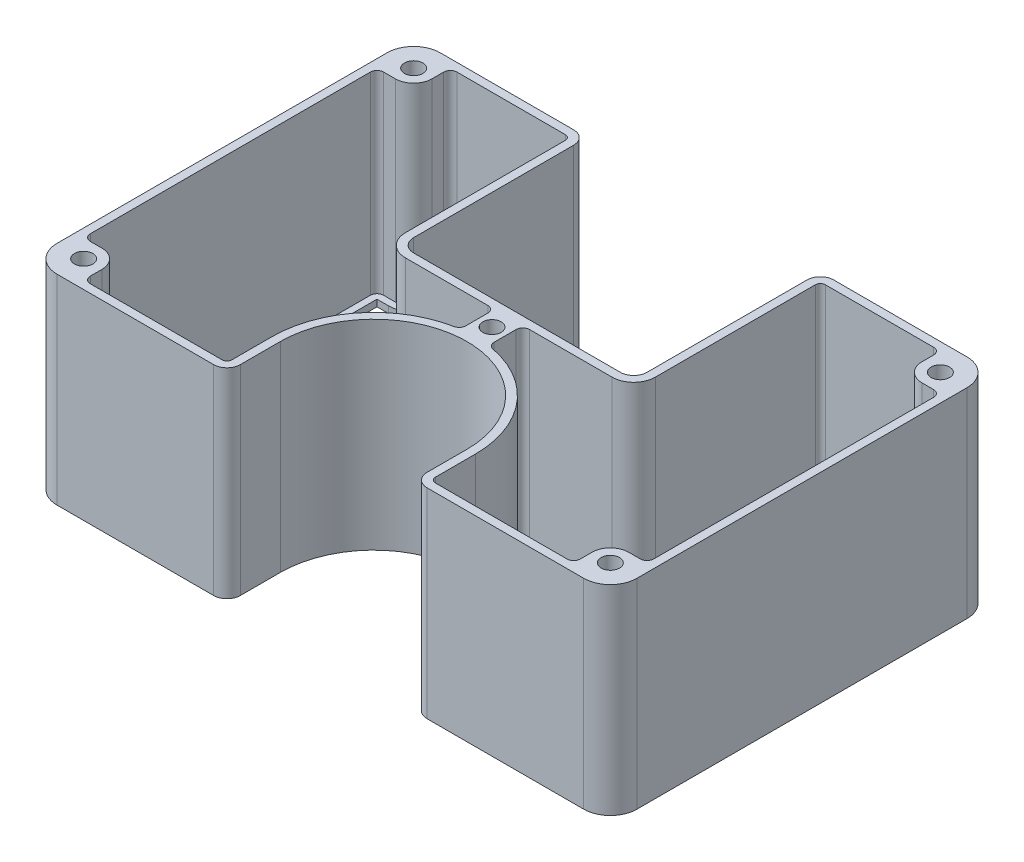
from build123d import *

# Parameters (mm, degrees)
SKETCH2_R           = 2.75
BOSS_EXTRUDE1_DEPTH = 60
BOSS_EXTRUDE2_DEPTH = 2


with BuildPart() as part:
    # Sketch2 → Boss-Extrude1 (new body)
    with BuildSketch(Plane(origin=(0, 0, 0), x_dir=(1, 0, 0), z_dir=(0, 1, 0))):
        with BuildLine():
            Line((87, -11), (87, 88))
            ThreePointArc((87, 88), (84.656854249, 93.656854249), (79, 96))
            Line((79, 96), (39, 96))
            ThreePointArc((39, 96), (36.171572875, 94.828427125), (35, 92))
            Line((35, 92), (35, 44))
            ThreePointArc((35, 44), (33.828427125, 41.171572875), (31, 40))
            Line((31, 40), (-31, 40))
            ThreePointArc((-31, 40), (-33.828427125, 41.171572875), (-35, 44))
            Line((-35, 44), (-35, 92))
            ThreePointArc((-35, 92), (-36.171572875, 94.828427125), (-39, 96))
            Line((-39, 96), (-79, 96))
            ThreePointArc((-79, 96), (-84.656854249, 93.656854249), (-87, 88))
            Line((-87, 88), (-87, -11))
            ThreePointArc((-87, -11), (-84.656854249, -16.656854249), (-79, -19))
            Line((-79, -19), (-32, -19))
            ThreePointArc((-32, -19), (-29.171572875, -17.828427125), (-28, -15))
            Line((-28, -15), (-28, -3))
            ThreePointArc((-28, -3), (0, 25), (28, -3))
            Line((28, -3), (28, -15))
            ThreePointArc((28, -15), (29.171572875, -17.828427125), (32, -19))
            Line((32, -19), (79, -19))
            ThreePointArc((79, -19), (84.656854249, -16.656854249), (87, -11))
        make_face()
        with Locations(Location((-79, 88, 0), (0, 0, 270))):
            Circle(SKETCH2_R, mode=Mode.SUBTRACT)
        with Locations(Location((79, 88, 0), (0, 0, 270))):
            Circle(SKETCH2_R, mode=Mode.SUBTRACT)
        with Locations(Location((79, -11, 0), (0, 0, 270))):
            Circle(SKETCH2_R, mode=Mode.SUBTRACT)
        with Locations(Location((-79, -11, 0), (0, 0, 270))):
            Circle(SKETCH2_R, mode=Mode.SUBTRACT)
        with Locations(Location((0, 32.5, 0), (0, 0, 270))):
            Circle(SKETCH2_R, mode=Mode.SUBTRACT)
        with BuildLine():
            Line((-39, 93.5), (-71.5, 93.5))
            ThreePointArc((-71.5, 93.5), (-72.914213562, 92.914213562), (-73.5, 91.5))
            Line((-73.5, 91.5), (-73.5, 88))
            ThreePointArc((-73.5, 88), (-75.110912703, 84.110912703), (-79, 82.5))
            Line((-79, 82.5), (-82.5, 82.5))
            ThreePointArc((-82.5, 82.5), (-83.914213562, 81.914213562), (-84.5, 80.5))
            Line((-84.5, 80.5), (-84.5, -3.5))
            ThreePointArc((-84.5, -3.5), (-83.914213562, -4.914213562), (-82.5, -5.5))
            Line((-82.5, -5.5), (-79, -5.5))
            ThreePointArc((-79, -5.5), (-75.110912703, -7.110912703), (-73.5, -11))
            Line((-73.5, -11), (-73.5, -14.5))
            ThreePointArc((-73.5, -14.5), (-72.914213562, -15.914213562), (-71.5, -16.5))
            Line((-71.5, -16.5), (-32, -16.5))
            ThreePointArc((-32, -16.5), (-30.939339828, -16.060660172), (-30.5, -15))
            Line((-30.5, -15), (-30.5, -3))
            ThreePointArc((-30.5, -3), (-23.549354883, 16.382411734), (-5.865384615, 26.930707698))
            ThreePointArc((-5.865384615, 26.930707698), (-4.705780008, 27.622399237), (-4.25, 28.893377055))
            Line((-4.25, 28.893377055), (-4.25, 35.5))
            ThreePointArc((-4.25, 35.5), (-4.835786438, 36.914213562), (-6.25, 37.5))
            Line((-6.25, 37.5), (-31, 37.5))
            ThreePointArc((-31, 37.5), (-35.596194078, 39.403805922), (-37.5, 44))
            Line((-37.5, 44), (-37.5, 92))
            ThreePointArc((-37.5, 92), (-37.939339828, 93.060660172), (-39, 93.5))
        make_face(mode=Mode.SUBTRACT)
        with BuildLine():
            Line((30.5, -15), (30.5, -3))
            ThreePointArc((30.5, -3), (23.549354883, 16.382411734), (5.865384615, 26.930707698))
            ThreePointArc((5.865384615, 26.930707698), (4.705780008, 27.622399237), (4.25, 28.893377055))
            Line((4.25, 28.893377055), (4.25, 35.5))
            ThreePointArc((4.25, 35.5), (4.835786438, 36.914213562), (6.25, 37.5))
            Line((6.25, 37.5), (31, 37.5))
            ThreePointArc((31, 37.5), (35.596194078, 39.403805922), (37.5, 44))
            Line((37.5, 44), (37.5, 92))
            ThreePointArc((37.5, 92), (37.939339828, 93.060660172), (39, 93.5))
            Line((39, 93.5), (71.5, 93.5))
            ThreePointArc((71.5, 93.5), (72.914213562, 92.914213562), (73.5, 91.5))
            Line((73.5, 91.5), (73.5, 88))
            ThreePointArc((73.5, 88), (75.110912703, 84.110912703), (79, 82.5))
            Line((79, 82.5), (82.5, 82.5))
            ThreePointArc((82.5, 82.5), (83.914213562, 81.914213562), (84.5, 80.5))
            Line((84.5, 80.5), (84.5, -3.5))
            ThreePointArc((84.5, -3.5), (83.914213562, -4.914213562), (82.5, -5.5))
            Line((82.5, -5.5), (79, -5.5))
            ThreePointArc((79, -5.5), (75.110912703, -7.110912703), (73.5, -11))
            Line((73.5, -11), (73.5, -14.5))
            ThreePointArc((73.5, -14.5), (72.914213562, -15.914213562), (71.5, -16.5))
            Line((71.5, -16.5), (32, -16.5))
            ThreePointArc((32, -16.5), (30.939339828, -16.060660172), (30.5, -15))
        make_face(mode=Mode.SUBTRACT)
    extrude(amount=BOSS_EXTRUDE1_DEPTH)

    # Sketch3 → Boss-Extrude2 (add)
    # profile 1 of 2: a face of its own
    with BuildSketch(Plane.XZ):
        with BuildLine():
            Line((-37.5, -92), (-37.5, -44))
            ThreePointArc((-37.5, -44), (-35.596194078, -39.403805922), (-31, -37.5))
            Line((-31, -37.5), (-6.25, -37.5))
            ThreePointArc((-6.25, -37.5), (-4.835786438, -36.914213562), (-4.25, -35.5))
            Line((-4.25, -35.5), (-4.25, -28.893377055))
            ThreePointArc((-4.25, -28.893377055), (-4.705780008, -27.622399237), (-5.865384615, -26.930707698))
            ThreePointArc((-5.865384615, -26.930707698), (-23.549354883, -16.382411734), (-30.5, 3))
            Line((-30.5, 3), (-30.5, 15))
            ThreePointArc((-30.5, 15), (-30.939339828, 16.060660172), (-32, 16.5))
            Line((-32, 16.5), (-71.5, 16.5))
            ThreePointArc((-71.5, 16.5), (-72.914213562, 15.914213562), (-73.5, 14.5))
            Line((-73.5, 14.5), (-73.5, 11))
            ThreePointArc((-73.5, 11), (-75.110912703, 7.110912703), (-79, 5.5))
            Line((-79, 5.5), (-82.5, 5.5))
            ThreePointArc((-82.5, 5.5), (-83.914213562, 4.914213562), (-84.5, 3.5))
            Line((-84.5, 3.5), (-84.5, -80.5))
            ThreePointArc((-84.5, -80.5), (-83.914213562, -81.914213562), (-82.5, -82.5))
            Line((-82.5, -82.5), (-79, -82.5))
            ThreePointArc((-79, -82.5), (-75.110912703, -84.110912703), (-73.5, -88))
            Line((-73.5, -88), (-73.5, -91.5))
            ThreePointArc((-73.5, -91.5), (-72.914213562, -92.914213562), (-71.5, -93.5))
            Line((-71.5, -93.5), (-39, -93.5))
            ThreePointArc((-39, -93.5), (-37.939339828, -93.060660172), (-37.5, -92))
        make_face()
        with BuildLine():
            Line((-39.5, -91.5), (-39.5, -44))
            ThreePointArc((-39.5, -44), (-37.01040764, -37.98959236), (-31, -35.5))
            Line((-31, -35.5), (-6.25, -35.5))
            Line((-6.25, -35.5), (-6.25, -28.893377055))
            ThreePointArc((-6.25, -28.893377055), (-25.093574875, -17.653389552), (-32.5, 3))
            Line((-32.5, 3), (-32.5, 14.5))
            Line((-32.5, 14.5), (-71.5, 14.5))
            Line((-71.5, 14.5), (-71.5, 11))
            ThreePointArc((-71.5, 11), (-73.696699141, 5.696699141), (-79, 3.5))
            Line((-79, 3.5), (-82.5, 3.5))
            Line((-82.5, 3.5), (-82.5, -80.5))
            Line((-82.5, -80.5), (-79, -80.5))
            ThreePointArc((-79, -80.5), (-73.696699141, -82.696699141), (-71.5, -88))
            Line((-71.5, -88), (-71.5, -91.5))
            Line((-71.5, -91.5), (-39.5, -91.5))
        make_face(mode=Mode.SUBTRACT)
    # profile 2 of 2: a face of its own
    with BuildSketch(Plane.XZ):
        with BuildLine():
            Line((30.5, 15), (30.5, 3))
            ThreePointArc((30.5, 3), (23.549354883, -16.382411734), (5.865384615, -26.930707698))
            ThreePointArc((5.865384615, -26.930707698), (4.705780008, -27.622399237), (4.25, -28.893377055))
            Line((4.25, -28.893377055), (4.25, -35.5))
            ThreePointArc((4.25, -35.5), (4.835786438, -36.914213562), (6.25, -37.5))
            Line((6.25, -37.5), (31, -37.5))
            ThreePointArc((31, -37.5), (35.596194078, -39.403805922), (37.5, -44))
            Line((37.5, -44), (37.5, -92))
            ThreePointArc((37.5, -92), (37.939339828, -93.060660172), (39, -93.5))
            Line((39, -93.5), (71.5, -93.5))
            ThreePointArc((71.5, -93.5), (72.914213562, -92.914213562), (73.5, -91.5))
            Line((73.5, -91.5), (73.5, -88))
            ThreePointArc((73.5, -88), (75.110912703, -84.110912703), (79, -82.5))
            Line((79, -82.5), (82.5, -82.5))
            ThreePointArc((82.5, -82.5), (83.914213562, -81.914213562), (84.5, -80.5))
            Line((84.5, -80.5), (84.5, 3.5))
            ThreePointArc((84.5, 3.5), (83.914213562, 4.914213562), (82.5, 5.5))
            Line((82.5, 5.5), (79, 5.5))
            ThreePointArc((79, 5.5), (75.110912703, 7.110912703), (73.5, 11))
            Line((73.5, 11), (73.5, 14.5))
            ThreePointArc((73.5, 14.5), (72.914213562, 15.914213562), (71.5, 16.5))
            Line((71.5, 16.5), (32, 16.5))
            ThreePointArc((32, 16.5), (30.939339828, 16.060660172), (30.5, 15))
        make_face()
        with BuildLine():
            Line((71.5, 14.5), (32.5, 14.5))
            Line((32.5, 14.5), (32.5, 3))
            ThreePointArc((32.5, 3), (25.093574875, -17.653389552), (6.25, -28.893377055))
            Line((6.25, -28.893377055), (6.25, -35.5))
            Line((6.25, -35.5), (31, -35.5))
            ThreePointArc((31, -35.5), (37.01040764, -37.98959236), (39.5, -44))
            Line((39.5, -44), (39.5, -91.5))
            Line((39.5, -91.5), (71.5, -91.5))
            Line((71.5, -91.5), (71.5, -88))
            ThreePointArc((71.5, -88), (73.696699141, -82.696699141), (79, -80.5))
            Line((79, -80.5), (82.5, -80.5))
            Line((82.5, -80.5), (82.5, 3.5))
            Line((82.5, 3.5), (79, 3.5))
            ThreePointArc((79, 3.5), (73.696699141, 5.696699141), (71.5, 11))
            Line((71.5, 11), (71.5, 14.5))
        make_face(mode=Mode.SUBTRACT)
    extrude(amount=-BOSS_EXTRUDE2_DEPTH)


solid = part.part
